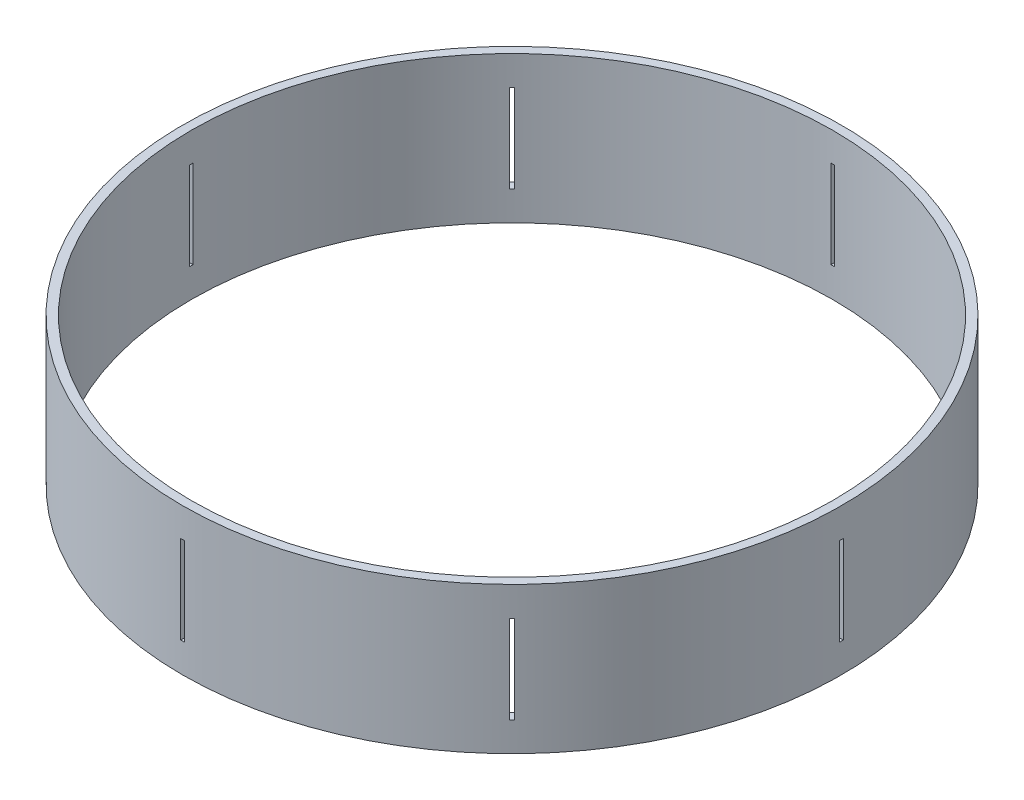
from build123d import *

# Parameters (mm, degrees)
SKETCH1_W                           = 3.81
SKETCH1_H                           = 63.5
CUT_EXTRUDE1_REACH                  = 281.224
CUT_EXTRUDE1_END_RADIUS             = 142.71625
SKETCH2_W                           = 1.524
SKETCH2_H                           = 38.1
CUT_EXTRUDE1_DIRECTION_2_REACH      = 281.224
CUT_EXTRUDE1_DIRECTION_2_END_RADIUS = 142.71625
CIRPATTERN1_COUNT                   = 4
CIRPATTERN1_ANGLE                   = 135


with BuildPart() as part:
    # Sketch1 → Revolve1 (revolve)
    with BuildSketch(Plane.XY, mode=Mode.PRIVATE) as revolve1_sk:
        with Locations((140.81125, 161.201652174)):
            Rectangle(SKETCH1_W, SKETCH1_H)
    revolve(revolve1_sk.sketch.rotate(Axis((0, 0, 0), (0, -1, 0)), 90), axis=Axis((0, 0, 0), (0, -1, 0)))

    # Cut-Extrude1: up to this cylinder (the profile starts inside it)
    cut_extrude1_end = Plane(origin=(0, 161.201652, 0), z_dir=(0, 1, 0)) * Cylinder(CUT_EXTRUDE1_END_RADIUS, 848.8805, mode=Mode.PRIVATE)
    # Sketch2 → Cut-Extrude1 (cut, up to the surface)
    with BuildSketch(Plane(origin=(0, 0, 0), x_dir=(0, 0, -1), z_dir=(1, 0, 0)), mode=Mode.PRIVATE) as cut_extrude1_sk1:
        with Locations((0, 161.201652174)):
            Rectangle(SKETCH2_W, SKETCH2_H)
    cut_extrude1_tool1 = extrude(cut_extrude1_sk1.sketch, amount=-CUT_EXTRUDE1_REACH, mode=Mode.PRIVATE) & cut_extrude1_end
    cut_extrude1 = cut_extrude1_tool1.solids().sort_by_distance((0, 161.201652, 0))[0]
    add(cut_extrude1, mode=Mode.SUBTRACT)

    # Cut-Extrude1 direction 2: up to this cylinder (the profile starts inside it)
    cut_extrude1_direction_2_end = Plane(origin=(0, 161.201652, 0), z_dir=(0, 1, 0)) * Cylinder(CUT_EXTRUDE1_DIRECTION_2_END_RADIUS, 848.8805, mode=Mode.PRIVATE)
    # Sketch2 → Cut-Extrude1 direction 2 (cut, up to the surface)
    with BuildSketch(Plane(origin=(0, 0, 0), x_dir=(0, 0, -1), z_dir=(1, 0, 0)), mode=Mode.PRIVATE) as cut_extrude1_direction_2_sk1:
        with Locations((0, 161.201652174)):
            Rectangle(SKETCH2_W, SKETCH2_H)
    cut_extrude1_direction_2_tool1 = extrude(cut_extrude1_direction_2_sk1.sketch, amount=CUT_EXTRUDE1_DIRECTION_2_REACH, mode=Mode.PRIVATE) & cut_extrude1_direction_2_end
    cut_extrude1_direction_2 = cut_extrude1_direction_2_tool1.solids().sort_by_distance((0, 161.201652, 0))[0]
    add(cut_extrude1_direction_2, mode=Mode.SUBTRACT)
    cut_extrude1 = cut_extrude1 + cut_extrude1_direction_2  # both directions under the feature's name, for the pattern or mirror that repeats it

    # CirPattern1: Cut-Extrude1 ×4 about axis
    cirpattern1_axis = Axis((0, 0, 0), (0, -1, 0))
    for i in range(1, CIRPATTERN1_COUNT):
        add(cut_extrude1.rotate(cirpattern1_axis, i * CIRPATTERN1_ANGLE / (CIRPATTERN1_COUNT - 1)), mode=Mode.SUBTRACT)


solid = part.part
